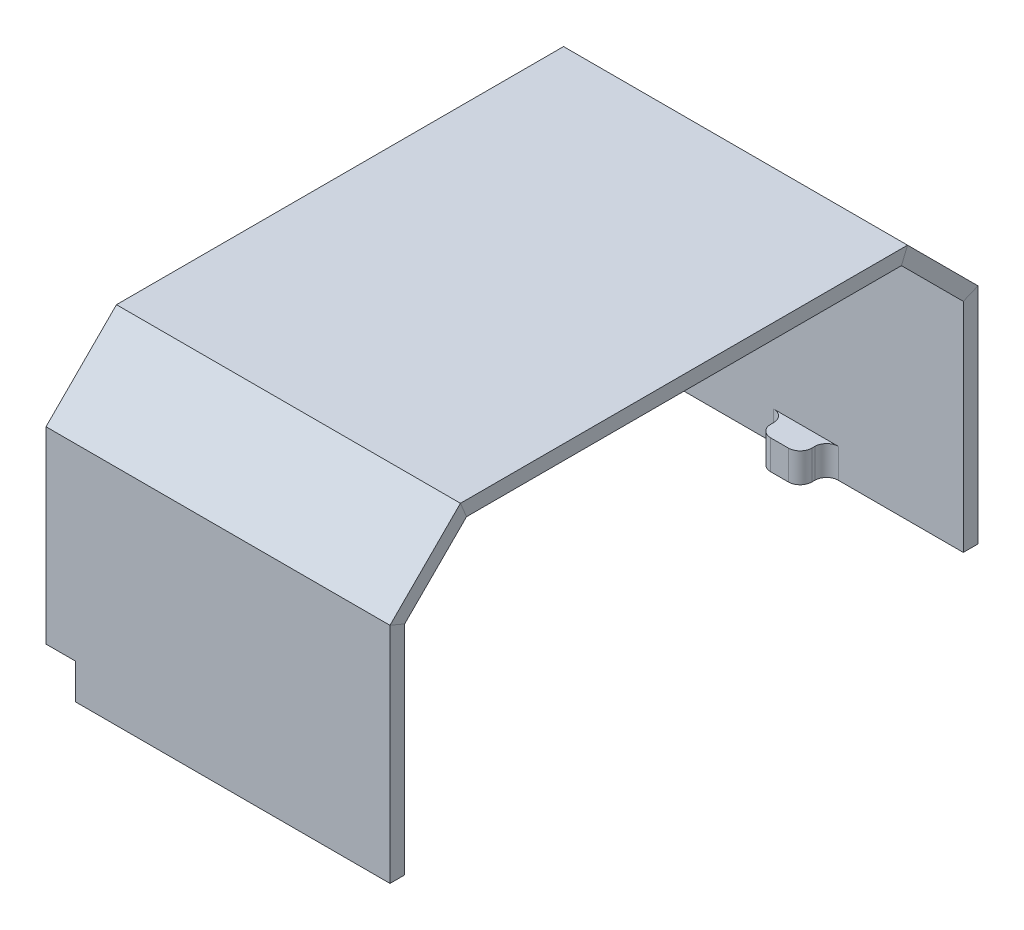
from build123d import *

# Parameters (mm, degrees)
SKETCH1_W           = 100
SKETCH1_H           = 5
BOSS_EXTRUDE1_DEPTH = 17
SKETCH6_W           = 10
SKETCH6_H           = 12
CUT_EXTRUDE1_DEPTH  = 234.428789998
SKETCH7_W           = 14
SKETCH7_H           = 14
BOSS_EXTRUDE2_DEPTH = 10
SKETCH8_R           = 6
CUT_EXTRUDE2_DEPTH  = 2
FILLET1_R           = 4
SKETCH9_W           = 14
SKETCH9_H           = 14
BOSS_EXTRUDE3_DEPTH = 10
SKETCH10_R          = 6
CUT_EXTRUDE3_DEPTH  = 2
FILLET2_R           = 4


with BuildPart() as part:
    # Sweep3: sweep along a path in Sketch2
    with BuildLine(Plane(origin=(0, 0, 0), x_dir=(0, 0, -1), z_dir=(1, 0, 0))) as sweep3_path:
        Line((-97.5, 0), (-97.5, 75))
        Line((-97.5, 75), (-75, 97.5))
        Line((-75, 97.5), (75, 97.5))
        Line((75, 97.5), (97.5, 75))
        Line((97.5, 75), (97.5, 0))
    # Sketch1 → Sweep3 (sweep)
    with BuildSketch(Plane(origin=(0, 0, 0), x_dir=(1, 0, 0), z_dir=(0, 1, 0))):
        with Locations((0, -97.5)):
            Rectangle(SKETCH1_W, SKETCH1_H)
    sweep(path=sweep3_path.line, transition=Transition.RIGHT)

    # Sketch5 → Boss-Extrude1 (add)
    with BuildSketch(Plane.ZY.offset(50)):
        Polygon((-100, 0), (-95, 0), (-95, 73.964466094), (-73.964466094, 95), (73.964466094, 95), (95, 73.964466094), (95, 0), (100, 0), (100, 76.035533906), (76.035533906, 100), (-76.035533906, 100), (-100, 76.035533906), align=None)
    extrude(amount=BOSS_EXTRUDE1_DEPTH)

    # Sketch6 → Cut-Extrude1 (cut, through all)
    with BuildSketch(Plane(origin=(0, 0, -100), x_dir=(-1, 0, 0), z_dir=(0, 0, -1))):
        with Locations((62, 6)):
            Rectangle(SKETCH6_W, SKETCH6_H)
    extrude(amount=-CUT_EXTRUDE1_DEPTH, mode=Mode.SUBTRACT)

    # Sketch7 → Boss-Extrude2 (add)
    with BuildSketch(Plane.XZ):
        with Locations((-3.5, 93)):
            Rectangle(SKETCH7_W, SKETCH7_H)
    extrude(amount=-BOSS_EXTRUDE2_DEPTH)

    # Sketch8 → Cut-Extrude2 (cut)
    with BuildSketch(Plane.XZ):
        with Locations(Location((-3.5, 93, 0), (0, 0, 270))):
            Circle(SKETCH8_R)
    extrude(amount=-CUT_EXTRUDE2_DEPTH, mode=Mode.SUBTRACT)

    # Fillet1
    fillet1_edges = [part.edges().sort_by_distance(p)[0] for p in [
        (3.5, 5, 95),
        (-10.5, 5, 95),
        (-10.5, 5, 86),
        (3.5, 5, 86),
    ]]
    fillet(fillet1_edges, radius=FILLET1_R)

    # Sketch9 → Boss-Extrude3 (add)
    with BuildSketch(Plane.XZ):
        with Locations((-3.5, -93)):
            Rectangle(SKETCH9_W, SKETCH9_H)
    extrude(amount=-BOSS_EXTRUDE3_DEPTH)

    # Sketch10 → Cut-Extrude3 (cut)
    with BuildSketch(Plane.XZ):
        with Locations(Location((-3.5, -93, 0), (0, 0, 270))):
            Circle(SKETCH10_R)
    extrude(amount=-CUT_EXTRUDE3_DEPTH, mode=Mode.SUBTRACT)

    # Fillet2
    fillet2_edges = [part.edges().sort_by_distance(p)[0] for p in [
        (3.5, 5, -86),
        (-10.5, 5, -95),
        (-10.5, 5, -86),
        (3.5, 5, -95),
    ]]
    fillet(fillet2_edges, radius=FILLET2_R)


solid = part.part
